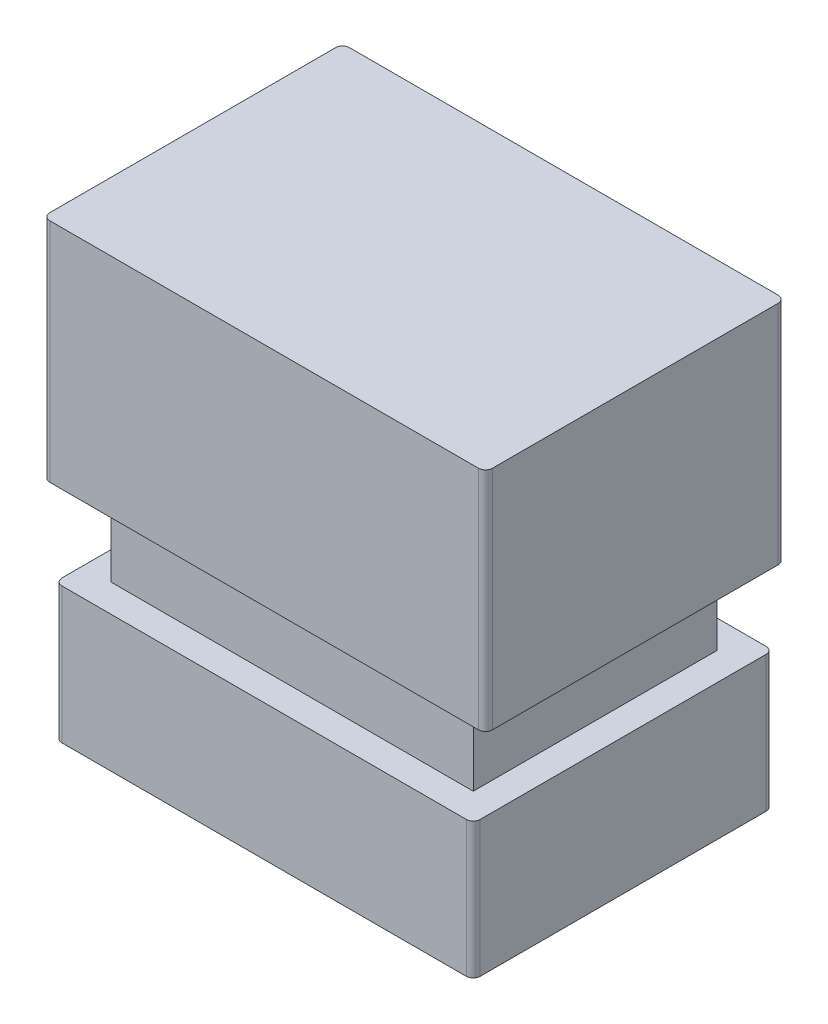
from build123d import *

# Parameters (mm, degrees)
SKETCH_1_W      = 600
SKETCH_1_H      = 430
EXTRUDE_1_DEPTH = 195
SKETCH_2_W      = 520
SKETCH_2_H      = 350
EXTRUDE_2_DEPTH = 120
SKETCH_3_W      = 635
SKETCH_3_H      = 430
EXTRUDE_3_DEPTH = 325
FILLET_2_R      = 10
FILLET_3_R      = 10


with BuildPart() as part:
    # 草圖1 → 填料-伸長1 (new body)
    with BuildSketch(Plane(origin=(0, 0, 0), x_dir=(1, 0, 0), z_dir=(0, 1, 0))):
        Rectangle(SKETCH_1_W, SKETCH_1_H)
    extrude(amount=EXTRUDE_1_DEPTH)

    # 草圖2 → 填料-伸長2 (add)
    with BuildSketch(Plane(origin=(0, 195, 0), x_dir=(1, 0, 0), z_dir=(0, 1, 0))):
        Rectangle(SKETCH_2_W, SKETCH_2_H)
    extrude(amount=EXTRUDE_2_DEPTH)

    # 草圖3 → 填料-伸長3 (add)
    with BuildSketch(Plane(origin=(0, 315, 0), x_dir=(1, 0, 0), z_dir=(0, 1, 0))):
        Rectangle(SKETCH_3_W, SKETCH_3_H)
    extrude(amount=EXTRUDE_3_DEPTH)

    # 圓角2
    fillet_2_edges = [part.edges().sort_by_distance(p)[0] for p in [
        (317.5, 477.5, 215),
        (317.5, 477.5, -215),
        (-317.5, 477.5, -215),
        (-317.5, 477.5, 215),
    ]]
    fillet(fillet_2_edges, radius=FILLET_2_R)

    # 圓角3
    fillet_3_edges = [part.edges().sort_by_distance(p)[0] for p in [
        (300, 97.5, 215),
        (-300, 97.5, 215),
        (-300, 97.5, -215),
        (300, 97.5, -215),
    ]]
    fillet(fillet_3_edges, radius=FILLET_3_R)


solid = part.part
